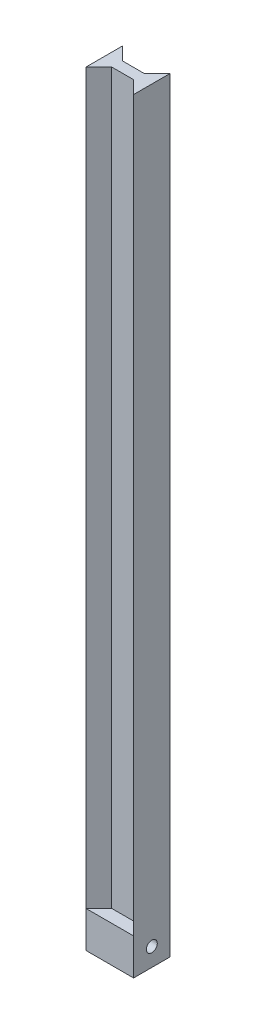
from build123d import *

# Parameters (mm, degrees)
BOSS_EXTRUDE1_DEPTH = 200
SKETCH2_W           = 13.071067812
SKETCH2_H           = 10
BOSS_EXTRUDE2_DEPTH = 10
SKETCH3_R           = 1.5
CUT_EXTRUDE1_DEPTH  = 30


with BuildPart() as part:
    # Sketch1 → Boss-Extrude1 (new body)
    with BuildSketch(Plane(origin=(0, 0, 0), x_dir=(1, 0, 0), z_dir=(0, 1, 0))):
        Polygon((0, 0), (-3.535533906, -3.535533906), (-9.535533906, -3.535533906), (-13.071067812, 0), (-13.071067812, -10), (-9.535533906, -6.464466094), (-3.535533906, -6.464466094), (0, -10), align=None)
    extrude(amount=BOSS_EXTRUDE1_DEPTH)

    # Sketch2 → Boss-Extrude2 (add)
    with BuildSketch(Plane.XZ):
        with Locations((-6.535533906, 5)):
            Rectangle(SKETCH2_W, SKETCH2_H)
    extrude(amount=BOSS_EXTRUDE2_DEPTH)

    # Sketch3 → Cut-Extrude1 (cut)
    with BuildSketch(Plane.ZY.offset(13.071067812)):
        with Locations((5, -5)):
            Circle(SKETCH3_R)
    extrude(amount=-CUT_EXTRUDE1_DEPTH, mode=Mode.SUBTRACT)


solid = part.part
